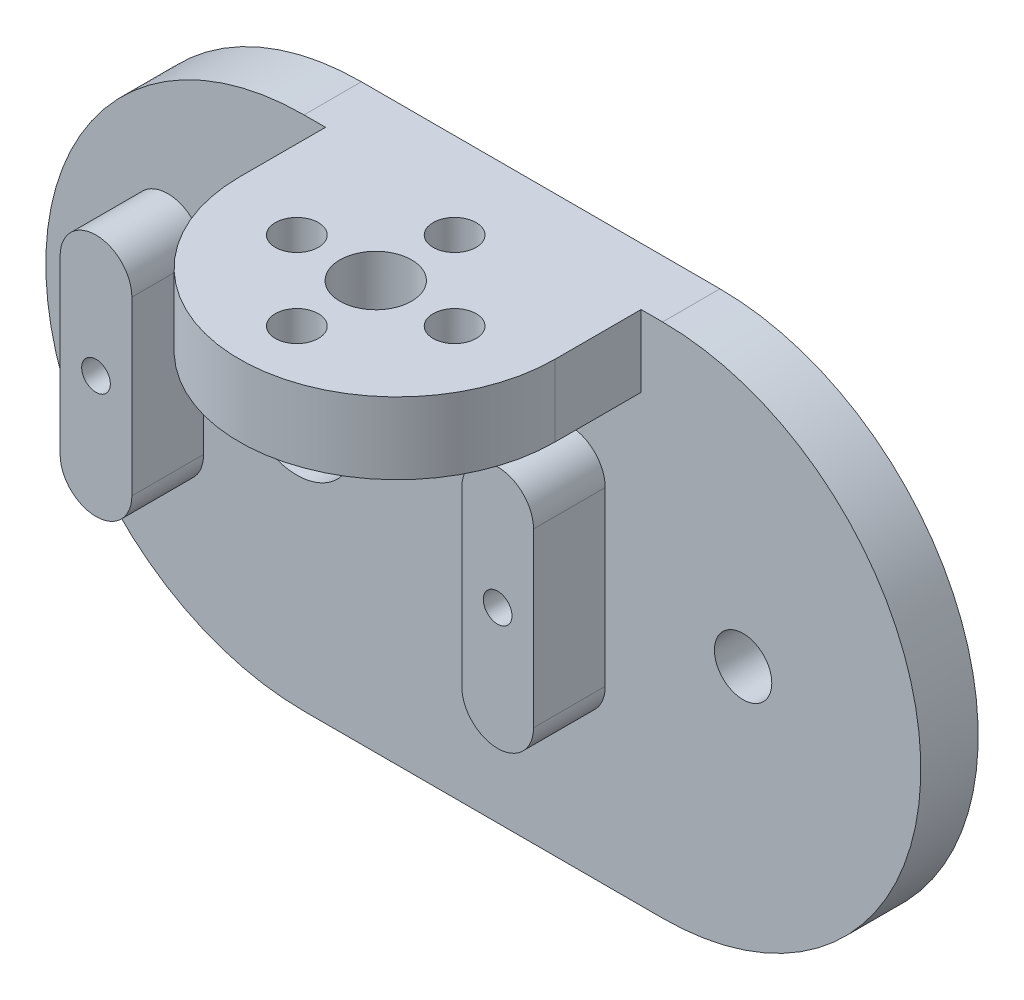
from build123d import *

# Parameters (mm, degrees)
BOSS_EXTRUDE1_DEPTH = 4
SKETCH2_R           = 1
BOSS_EXTRUDE2_DEPTH = 5
CUT_EXTRUDE1_START  = -5
SKETCH2_3_R         = 4
SKETCH2_3_R_2       = 2
SKETCH2_3_R_3       = 1
CUT_EXTRUDE1_DEPTH  = 5
SKETCH3_W           = 22
SKETCH3_H           = 5
BOSS_EXTRUDE3_DEPTH = 17
FILLET1_RADIUS      = 11
FILLET1_LENGTH      = 5
SKETCH5_R           = 2.5
SKETCH5_R_2         = 1.5
CUT_EXTRUDE3_DEPTH  = 17


with BuildPart() as part:
    # Sketch1 → Boss-Extrude1 (new body)
    with BuildSketch(Plane.XY):
        with BuildLine():
            Line((-12.5, 18), (12.5, 18))
            ThreePointArc((12.5, 18), (30.5, 0), (12.5, -18))
            Line((12.5, -18), (-12.5, -18))
            ThreePointArc((-12.5, -18), (-30.5, 0), (-12.5, 18))
        make_face()
    extrude(amount=BOSS_EXTRUDE1_DEPTH)

    # Sketch2 → Boss-Extrude2 (add)
    # profile 1 of 2: a face of its own
    with BuildSketch(Plane.XY.offset(4)):
        with BuildLine():
            Line((-24.5, 6), (-24.5, -6))
            ThreePointArc((-24.5, -6), (-22, -8.5), (-19.5, -6))
            Line((-19.5, -6), (-19.5, 6))
            ThreePointArc((-19.5, 6), (-22, 8.5), (-24.5, 6))
        make_face()
        with Locations((-22, 0)):
            Circle(SKETCH2_R, mode=Mode.SUBTRACT)
    # profile 2 of 2: a face of its own
    with BuildSketch(Plane.XY.offset(4)):
        with BuildLine():
            Line((3.5, 6), (3.5, -6))
            ThreePointArc((3.5, -6), (6, -8.5), (8.5, -6))
            Line((8.5, -6), (8.5, 6))
            ThreePointArc((8.5, 6), (6, 8.5), (3.5, 6))
        make_face()
        with Locations((6, 0)):
            Circle(SKETCH2_R, mode=Mode.SUBTRACT)
    extrude(amount=BOSS_EXTRUDE2_DEPTH)

    # Sketch2<3> → Cut-Extrude1 (cut)
    with BuildSketch(Plane.XY.offset(4).offset(CUT_EXTRUDE1_START)):
        with Locations((-13, 0)):
            Circle(SKETCH2_3_R)
        with Locations((18.110196417, 0)):
            Circle(SKETCH2_3_R_2)
        with Locations((-22, 0)):
            Circle(SKETCH2_3_R_3)
        with Locations((6, 0)):
            Circle(SKETCH2_3_R_3)
    extrude(amount=CUT_EXTRUDE1_DEPTH, mode=Mode.SUBTRACT)

    # Sketch3 → Boss-Extrude3 (add)
    with BuildSketch(Plane.XY.offset(4)):
        with Locations((0, 15.5)):
            Rectangle(SKETCH3_W, SKETCH3_H)
    extrude(amount=BOSS_EXTRUDE3_DEPTH)

    # Fillet1: full round fillet: the end face becomes a half cylinder, R = half its width
    fillet1_face = Plane((0, 15.5, 21), x_dir=(0, 1, 0), z_dir=(0, 0, 1))  # on the end face: x along it, z out of the body
    fillet1_slab = fillet1_face.offset(-FILLET1_RADIUS / 2) * Box(FILLET1_LENGTH, 2 * FILLET1_RADIUS, FILLET1_RADIUS, mode=Mode.PRIVATE)  # the body's end, R deep
    fillet1_round = Plane((0, 15.5, 10), x_dir=(0, 0, 1), z_dir=(0, 1, 0)) * Cylinder(FILLET1_RADIUS, FILLET1_LENGTH, mode=Mode.PRIVATE)  # its axis R under the face
    add(fillet1_slab - fillet1_round, mode=Mode.SUBTRACT)

    # Sketch5 → Cut-Extrude3 (cut)
    with BuildSketch(Plane.XZ.offset(-13)):
        with Locations((0, 11.5)):
            Circle(SKETCH5_R)
        with Locations((5.5, 11.5)):
            Circle(SKETCH5_R_2)
        with Locations((0, 17)):
            Circle(SKETCH5_R_2)
        with Locations((-5.5, 11.5)):
            Circle(SKETCH5_R_2)
        with Locations((0, 6)):
            Circle(SKETCH5_R_2)
    extrude(amount=-CUT_EXTRUDE3_DEPTH, mode=Mode.SUBTRACT)


solid = part.part
